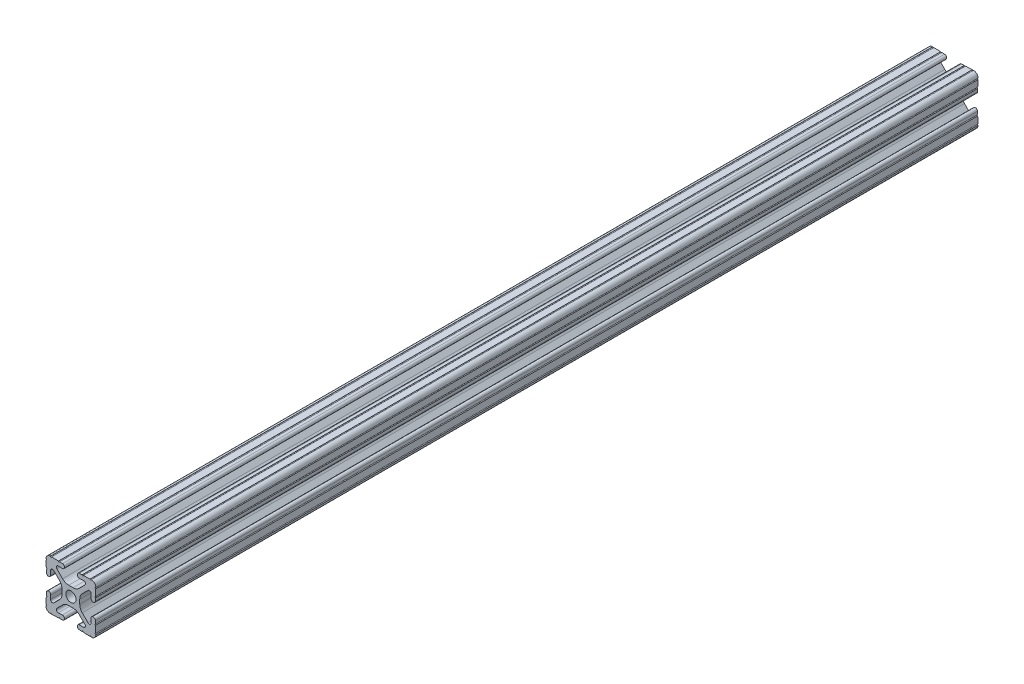
from build123d import *

# Parameters (mm, degrees)
SKETCH3_R      = 2.6035
EXTRUDE1_DEPTH = 225


with BuildPart() as part:
    # Sketch3 → Extrude1 (new, symmetric)
    with BuildSketch(Plane.XY):
        with BuildLine():
            Line((-1.115277175, 4.5085), (1.115277175, 4.5085))
            ThreePointArc((1.115277175, 4.5085), (2.806584872, 4.844922018), (4.240406305, 5.80297087))
            Line((4.240406305, 5.80297087), (7.148423664, 8.710988229))
            ThreePointArc((7.148423664, 8.710988229), (7.349906316, 9.772227925), (6.436353897, 10.348636575))
            Line((6.436353897, 10.348636575), (4.381960454, 10.276895575))
            ThreePointArc((4.381960454, 10.276895575), (3.239173075, 11.342562046), (4.304839546, 12.485349424))
            Line((4.304839546, 12.485349424), (5.728246175, 12.535055879))
            ThreePointArc((5.728246175, 12.535055879), (6.054756855, 12.230579745), (6.35923299, 12.557090424))
            Line((6.35923299, 12.557090424), (9.782092278, 12.676619304))
            ThreePointArc((9.782092278, 12.676619304), (10.108602958, 12.37214317), (10.413079092, 12.69865385))
            ThreePointArc((10.413079092, 12.69865385), (12.052764565, 12.052764565), (12.69865385, 10.413079092))
            ThreePointArc((12.69865385, 10.413079092), (12.37214317, 10.108602958), (12.676619304, 9.782092278))
            Line((12.676619304, 9.782092278), (12.557090424, 6.35923299))
            ThreePointArc((12.557090424, 6.35923299), (12.230579745, 6.054756855), (12.535055879, 5.728246175))
            Line((12.535055879, 5.728246175), (12.485349424, 4.304839546))
            ThreePointArc((12.485349424, 4.304839546), (11.342562046, 3.239173075), (10.276895575, 4.381960454))
            Line((10.276895575, 4.381960454), (10.348636575, 6.436353897))
            ThreePointArc((10.348636575, 6.436353897), (9.772227925, 7.349906316), (8.710988229, 7.148423664))
            Line((8.710988229, 7.148423664), (5.80297087, 4.240406305))
            ThreePointArc((5.80297087, 4.240406305), (4.844922018, 2.806584872), (4.5085, 1.115277175))
            Line((4.5085, 1.115277175), (4.5085, -1.115277175))
            ThreePointArc((4.5085, -1.115277175), (4.844922018, -2.806584872), (5.80297087, -4.240406305))
            Line((5.80297087, -4.240406305), (8.710988229, -7.148423664))
            ThreePointArc((8.710988229, -7.148423664), (9.772227925, -7.349906316), (10.348636575, -6.436353897))
            Line((10.348636575, -6.436353897), (10.276895575, -4.381960454))
            ThreePointArc((10.276895575, -4.381960454), (11.342562046, -3.239173075), (12.485349424, -4.304839546))
            Line((12.485349424, -4.304839546), (12.535055879, -5.728246175))
            ThreePointArc((12.535055879, -5.728246175), (12.230579745, -6.054756855), (12.557090424, -6.35923299))
            Line((12.557090424, -6.35923299), (12.676619304, -9.782092278))
            ThreePointArc((12.676619304, -9.782092278), (12.37214317, -10.108602958), (12.69865385, -10.413079092))
            ThreePointArc((12.69865385, -10.413079092), (12.052764565, -12.052764565), (10.413079092, -12.69865385))
            ThreePointArc((10.413079092, -12.69865385), (10.108602958, -12.37214317), (9.782092278, -12.676619304))
            Line((9.782092278, -12.676619304), (6.35923299, -12.557090424))
            ThreePointArc((6.35923299, -12.557090424), (6.054756855, -12.230579745), (5.728246175, -12.535055879))
            Line((5.728246175, -12.535055879), (4.304839546, -12.485349424))
            ThreePointArc((4.304839546, -12.485349424), (3.239173075, -11.342562046), (4.381960454, -10.276895575))
            Line((4.381960454, -10.276895575), (6.436353897, -10.348636575))
            ThreePointArc((6.436353897, -10.348636575), (7.349906316, -9.772227925), (7.148423664, -8.710988229))
            Line((7.148423664, -8.710988229), (4.240406305, -5.80297087))
            ThreePointArc((4.240406305, -5.80297087), (2.806584872, -4.844922018), (1.115277175, -4.5085))
            Line((1.115277175, -4.5085), (-1.115277175, -4.5085))
            ThreePointArc((-1.115277175, -4.5085), (-2.806584872, -4.844922018), (-4.240406305, -5.80297087))
            Line((-4.240406305, -5.80297087), (-7.148423664, -8.710988229))
            ThreePointArc((-7.148423664, -8.710988229), (-7.349906316, -9.772227925), (-6.436353897, -10.348636575))
            Line((-6.436353897, -10.348636575), (-4.381960454, -10.276895575))
            ThreePointArc((-4.381960454, -10.276895575), (-3.239173075, -11.342562046), (-4.304839546, -12.485349424))
            Line((-4.304839546, -12.485349424), (-5.728246175, -12.535055879))
            ThreePointArc((-5.728246175, -12.535055879), (-6.054756855, -12.230579745), (-6.35923299, -12.557090424))
            Line((-6.35923299, -12.557090424), (-9.782092278, -12.676619304))
            ThreePointArc((-9.782092278, -12.676619304), (-10.108602958, -12.37214317), (-10.413079092, -12.69865385))
            ThreePointArc((-10.413079092, -12.69865385), (-12.052764565, -12.052764565), (-12.69865385, -10.413079092))
            ThreePointArc((-12.69865385, -10.413079092), (-12.37214317, -10.108602958), (-12.676619304, -9.782092278))
            Line((-12.676619304, -9.782092278), (-12.557090424, -6.35923299))
            ThreePointArc((-12.557090424, -6.35923299), (-12.230579745, -6.054756855), (-12.535055879, -5.728246175))
            Line((-12.535055879, -5.728246175), (-12.485349424, -4.304839546))
            ThreePointArc((-12.485349424, -4.304839546), (-11.342562046, -3.239173075), (-10.276895575, -4.381960454))
            Line((-10.276895575, -4.381960454), (-10.348636575, -6.436353897))
            ThreePointArc((-10.348636575, -6.436353897), (-9.772227925, -7.349906316), (-8.710988229, -7.148423664))
            Line((-8.710988229, -7.148423664), (-5.80297087, -4.240406305))
            ThreePointArc((-5.80297087, -4.240406305), (-4.844922018, -2.806584872), (-4.5085, -1.115277175))
            Line((-4.5085, -1.115277175), (-4.5085, 1.115277175))
            ThreePointArc((-4.5085, 1.115277175), (-4.844922018, 2.806584872), (-5.80297087, 4.240406305))
            Line((-5.80297087, 4.240406305), (-8.710988229, 7.148423664))
            ThreePointArc((-8.710988229, 7.148423664), (-9.772227925, 7.349906316), (-10.348636575, 6.436353897))
            Line((-10.348636575, 6.436353897), (-10.276895575, 4.381960454))
            ThreePointArc((-10.276895575, 4.381960454), (-11.342562046, 3.239173075), (-12.485349424, 4.304839546))
            Line((-12.485349424, 4.304839546), (-12.535055879, 5.728246175))
            ThreePointArc((-12.535055879, 5.728246175), (-12.230579745, 6.054756855), (-12.557090424, 6.35923299))
            Line((-12.557090424, 6.35923299), (-12.676619304, 9.782092278))
            ThreePointArc((-12.676619304, 9.782092278), (-12.37214317, 10.108602958), (-12.69865385, 10.413079092))
            ThreePointArc((-12.69865385, 10.413079092), (-12.052764565, 12.052764565), (-10.413079092, 12.69865385))
            ThreePointArc((-10.413079092, 12.69865385), (-10.108602958, 12.37214317), (-9.782092278, 12.676619304))
            Line((-9.782092278, 12.676619304), (-6.35923299, 12.557090424))
            ThreePointArc((-6.35923299, 12.557090424), (-6.054756855, 12.230579745), (-5.728246175, 12.535055879))
            Line((-5.728246175, 12.535055879), (-4.304839546, 12.485349424))
            ThreePointArc((-4.304839546, 12.485349424), (-3.239173075, 11.342562046), (-4.381960454, 10.276895575))
            Line((-4.381960454, 10.276895575), (-6.436353897, 10.348636575))
            ThreePointArc((-6.436353897, 10.348636575), (-7.349906316, 9.772227925), (-7.148423664, 8.710988229))
            Line((-7.148423664, 8.710988229), (-4.240406305, 5.80297087))
            ThreePointArc((-4.240406305, 5.80297087), (-2.806584872, 4.844922018), (-1.115277175, 4.5085))
        make_face()
        Circle(SKETCH3_R, mode=Mode.SUBTRACT)
    extrude(amount=EXTRUDE1_DEPTH, both=True)


solid = part.part
